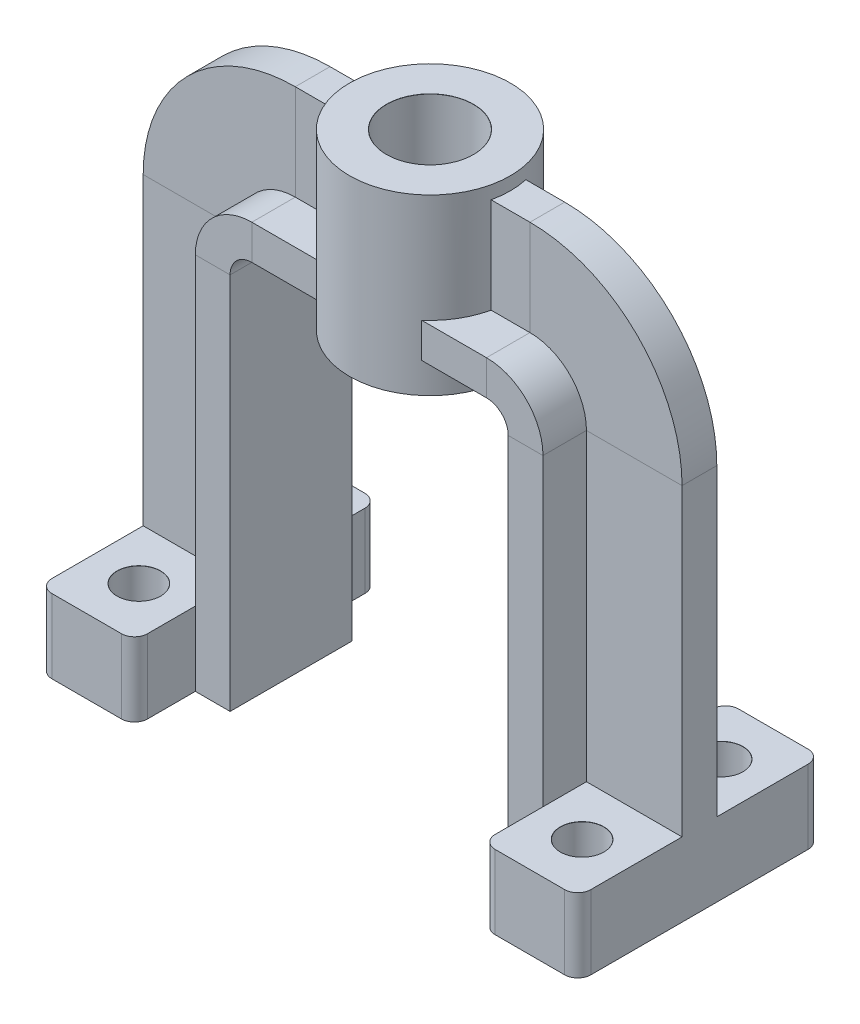
from build123d import *

# Parameters (mm, degrees)
SKETCH5_W                            = 56
SKETCH5_H                            = 17
BOSS_EXTRUDE1_DEPTH                  = 22
F_10_0_10_DIAMETER_HOLE1_D           = 10
F_10_0_10_DIAMETER_HOLE1_CSINK_D     = 10.05
F_10_0_10_DIAMETER_HOLE1_CSINK_ANGLE = 90
FILLET1_R                            = 3
SKETCH10_R                           = 18.5
BOSS_EXTRUDE2_DEPTH                  = 40
F_20_0_20_DIAMETER_HOLE1_D           = 20
F_20_0_20_DIAMETER_HOLE1_CSINK_D     = 20.05
F_20_0_20_DIAMETER_HOLE1_CSINK_ANGLE = 90


with BuildPart() as part:
    # Sweep1: sweep along a path in Sketch2
    with BuildLine(Plane.XY) as sweep1_path:
        Line((-32, 0), (-32, 87))
        ThreePointArc((-32, 87), (-30.535533906, 90.535533906), (-27, 92))
        Line((-27, 92), (0, 92))
    # Sketch1 → Sweep1 (sweep)
    with BuildSketch(Plane(origin=(0, 0, 0), x_dir=(1, 0, 0), z_dir=(0, 1, 0))):
        Polygon((-32, 14), (-32, -14), (-40, -14), (-40, -4), (-62, -4), (-62, 4), (-40, 4), (-40, 14), align=None)
    sweep(path=sweep1_path.line)

    # Sketch5 → Boss-Extrude1 (add)
    with BuildSketch(Plane.ZY.offset(62)):
        with Locations((0, 8.5)):
            Rectangle(SKETCH5_W, SKETCH5_H)
    extrude(amount=-BOSS_EXTRUDE1_DEPTH)

    # Ø10.0 (10) Diameter Hole1 (through all)
    with Locations(Plane(origin=(-51, 17, 16), x_dir=(0, 0, 1), z_dir=(0, 1, 0))):
        with Locations((0, 0)):
            f_10_0_10_diameter_hole1 = CounterSinkHole(F_10_0_10_DIAMETER_HOLE1_D / 2, F_10_0_10_DIAMETER_HOLE1_CSINK_D / 2, counter_sink_angle=F_10_0_10_DIAMETER_HOLE1_CSINK_ANGLE)

    # Mirror1: Ø10.0 (10) Diameter Hole1 across plane
    add(f_10_0_10_diameter_hole1.mirror(Plane.XY), mode=Mode.SUBTRACT)

    # Fillet1
    fillet1_edges = [part.edges().sort_by_distance(p)[0] for p in [
        (-40, 8.5, -28),
        (-62, 8.5, -28),
        (-40, 8.5, 28),
        (-62, 8.5, 28),
    ]]
    fillet(fillet1_edges, radius=FILLET1_R)

    # Mirror2: part across plane


with BuildPart() as part_1:
    add(part.part)
    add(part.part.mirror(Plane(origin=(0, 0, 0), x_dir=(0, 0, 1), z_dir=(1, 0, 0))))

    # Sketch10 → Boss-Extrude2 (add)
    with BuildSketch(Plane(origin=(0, 125, 0), x_dir=(1, 0, 0), z_dir=(0, 1, 0))):
        with Locations(Location((0, 0, 0), (0, 0, 270))):
            Circle(SKETCH10_R)
    extrude(amount=-BOSS_EXTRUDE2_DEPTH)

    # Ø20.0 (20) Diameter Hole1 (through all)
    with Locations(Plane.ZX.offset(125)):
        with Locations((0, 0)):
            CounterSinkHole(F_20_0_20_DIAMETER_HOLE1_D / 2, F_20_0_20_DIAMETER_HOLE1_CSINK_D / 2, counter_sink_angle=F_20_0_20_DIAMETER_HOLE1_CSINK_ANGLE)


solid = part_1.part
